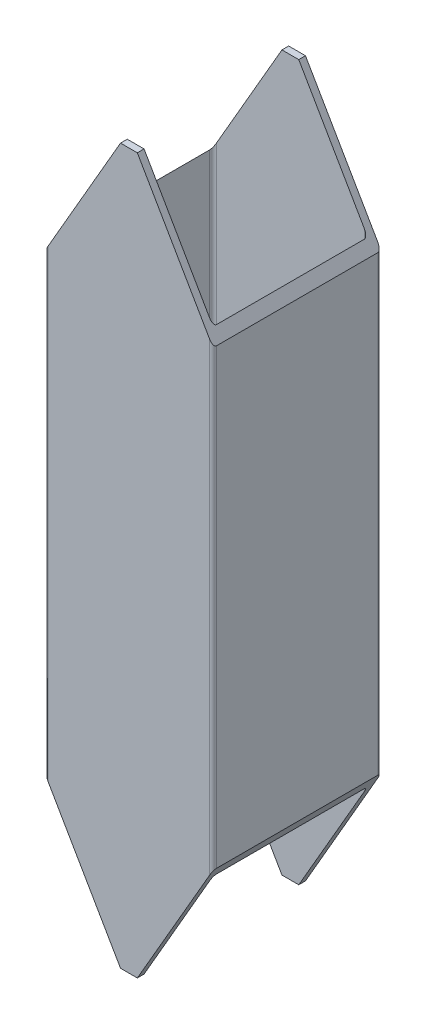
from build123d import *

# Parameters (mm, degrees)
BOSS_EXTRU_1_DEPTH      = 425
ENL_V_MAT_EXTRU_1_DEPTH = 448.911821679


with BuildPart() as part:
    # Esquisse2 → Boss.-Extru.1 (new body)
    with BuildSketch(Plane(origin=(0, 0, 0), x_dir=(1, 0, 0), z_dir=(0, 1, 0))):
        with BuildLine():
            Line((2, 0), (98, 0))
            ThreePointArc((98, 0), (99.414213562, 0.585786438), (100, 2))
            Line((100, 2), (100, 98))
            ThreePointArc((100, 98), (99.414213562, 99.414213562), (98, 100))
            Line((98, 100), (2, 100))
            ThreePointArc((2, 100), (0.585786438, 99.414213562), (0, 98))
            Line((0, 98), (0, 2))
            ThreePointArc((0, 2), (0.585786438, 0.585786438), (2, 0))
        make_face()
        with BuildLine():
            Line((6, 96), (94, 96))
            ThreePointArc((94, 96), (95.414213562, 95.414213562), (96, 94))
            Line((96, 94), (96, 6))
            ThreePointArc((96, 6), (95.414213562, 4.585786438), (94, 4))
            Line((94, 4), (6, 4))
            ThreePointArc((6, 4), (4.585786438, 4.585786438), (4, 6))
            Line((4, 6), (4, 94))
            ThreePointArc((4, 94), (4.585786438, 95.414213562), (6, 96))
        make_face(mode=Mode.SUBTRACT)
    extrude(amount=BOSS_EXTRU_1_DEPTH)

    # Esquisse3 → Enlèv. mat.-Extru.1 (cut, through all)
    with BuildSketch(Plane.XY):
        Polygon((45, 425), (0, 347.057713659), (-62.450183936, 347.057713659), (-62.450183936, 486.30167962), (45, 486.30167962), align=None)
        Polygon((45, 0), (0, 77.942286341), (-44.197295574, 77.942286341), (-44.197295574, -11.830713302), (45, -11.830713302), align=None)
        Polygon((55, -11.830713302), (55, 0), (100, 77.942286341), (144.197295574, 77.942286341), (144.197295574, -11.830713302), align=None)
        Polygon((55, 486.30167962), (55, 425), (100, 347.057713659), (162.450183936, 347.057713659), (162.450183936, 486.30167962), align=None)
    extrude(amount=-ENL_V_MAT_EXTRU_1_DEPTH, mode=Mode.SUBTRACT)


solid = part.part
